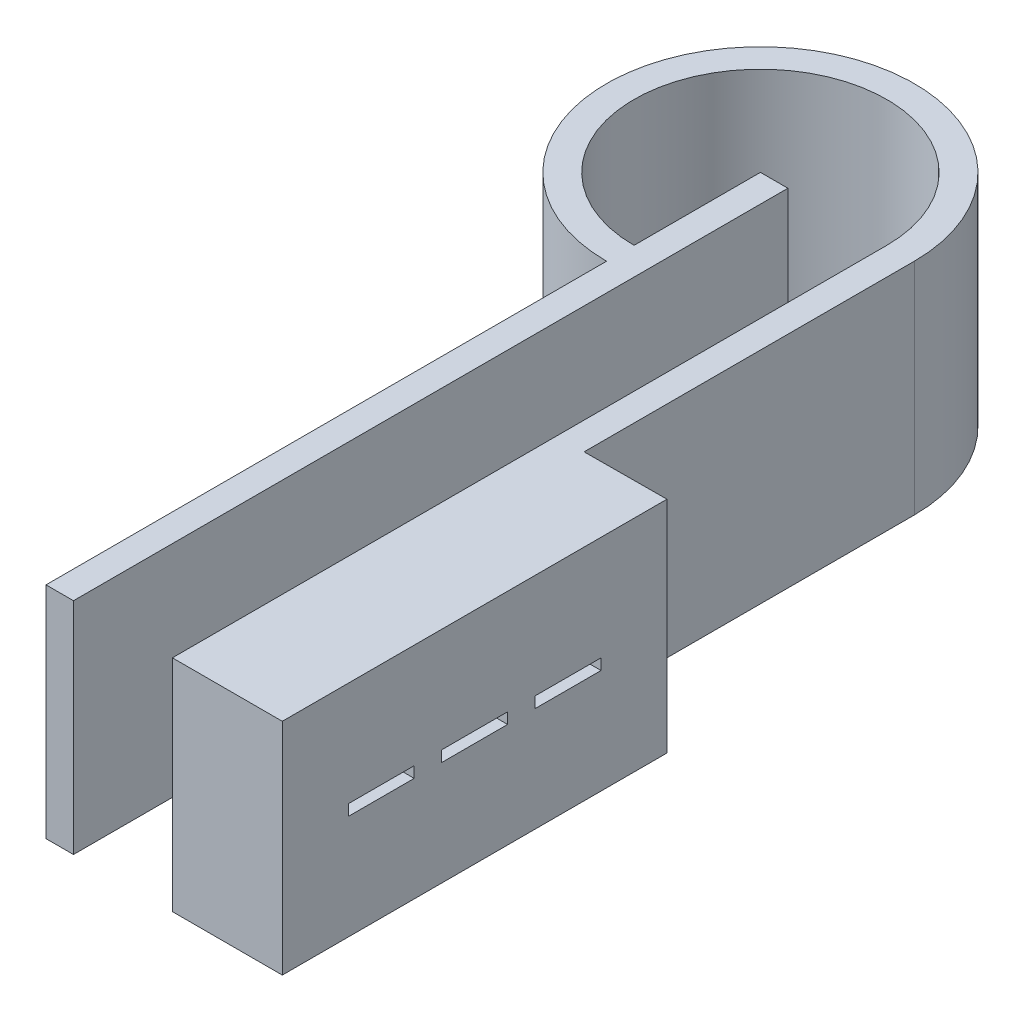
from build123d import *

# Parameters (mm, degrees)
BOSS_EXTRUDE1_DEPTH = 20
SKETCH2_R           = 4
CUT_EXTRUDE2_DEPTH  = 8
CUT_EXTRUDE4_DEPTH  = 10
SKETCH6_W           = 2.5
SKETCH6_H           = 20
SKETCH6_W_2         = 10
BOSS_EXTRUDE3_DEPTH = 5


with BuildPart() as part:
    # Sketch1 → Boss-Extrude1 (new body)
    with BuildSketch(Plane(origin=(0, 0, 0), x_dir=(1, 0, 0), z_dir=(0, 1, 0))):
        with BuildLine():
            Line((-29.801242739, -7.293134051), (-29.801242739, 22.74889672))
            ThreePointArc((-29.801242739, 22.74889672), (-53.700737675, 32.648391657), (-43.801242739, 8.74889672))
            Line((-43.801242739, 8.74889672), (-43.801242739, -37.25110328))
            Line((-43.801242739, -37.25110328), (-41.301242739, -37.25110328))
            Line((-41.301242739, -37.25110328), (-41.301242739, 22.74889672))
            Line((-41.301242739, 22.74889672), (-43.801242739, 22.74889672))
            Line((-43.801242739, 22.74889672), (-43.801242739, 11.24889672))
            ThreePointArc((-43.801242739, 11.24889672), (-51.932970722, 30.880624704), (-32.301242739, 22.74889672))
            Line((-32.301242739, 22.74889672), (-32.301242739, -37.25110328))
            Line((-32.301242739, -37.25110328), (-22.301242739, -37.25110328))
            Line((-22.301242739, -37.25110328), (-22.301242739, -7.25110328))
            Line((-22.301242739, -7.25110328), (-29.801242739, -7.293134051))
        make_face()
    extrude(amount=BOSS_EXTRUDE1_DEPTH)

    # Sketch2 → Cut-Extrude2 (cut)
    with BuildSketch(Plane.ZY.offset(32.301242739)):
        with Locations((16.25110328, 10)):
            Circle(SKETCH2_R)
        with Locations((33.20110328, 10)):
            Circle(SKETCH2_R)
        with Locations((24.75110328, 10)):
            Circle(SKETCH2_R)
    extrude(amount=-CUT_EXTRUDE2_DEPTH, mode=Mode.SUBTRACT)

    # Sketch3 → Cut-Extrude4 (cut)
    with BuildSketch(Plane(origin=(-22.301242739, 0, 0), x_dir=(0, 0, -1), z_dir=(1, 0, 0))):
        Polygon((-24.75110328, 10), (-27.75110328, 10.5), (-27.75110328, 9.5), align=None)
        Polygon((-21.75110328, 10.5), (-27.75110328, 10.5), (-24.75110328, 10), align=None)
        Polygon((-21.75110328, 10.5), (-24.75110328, 10), (-21.75110328, 9.5), align=None)
        Polygon((-21.75110328, 9.5), (-24.75110328, 10), (-27.75110328, 9.5), align=None)
        Polygon((-16.25110328, 10), (-19.25110328, 10.5), (-19.25110328, 9.5), align=None)
        Polygon((-13.25110328, 10.5), (-16.25110328, 10), (-13.25110328, 9.5), align=None)
        Polygon((-13.25110328, 10.5), (-19.25110328, 10.5), (-16.25110328, 10), align=None)
        Polygon((-13.25110328, 9.5), (-16.25110328, 10), (-19.25110328, 9.5), align=None)
        Polygon((-30.25110328, 10.5), (-33.25110328, 10), (-30.25110328, 9.5), align=None)
        Polygon((-30.25110328, 10.5), (-36.25110328, 10.5), (-33.25110328, 10), align=None)
        Polygon((-33.25110328, 10), (-36.25110328, 10.5), (-36.25110328, 9.5), align=None)
        Polygon((-30.25110328, 9.5), (-33.25110328, 10), (-36.25110328, 9.5), align=None)
    extrude(amount=-CUT_EXTRUDE4_DEPTH, mode=Mode.SUBTRACT)

    # Sketch6 → Boss-Extrude3 (add)
    with BuildSketch(Plane.XY.offset(37.25110328)):
        with Locations((-42.551242739, 10)):
            Rectangle(SKETCH6_W, SKETCH6_H)
        with Locations((-27.301242739, 10)):
            Rectangle(SKETCH6_W_2, SKETCH6_H)
    extrude(amount=BOSS_EXTRUDE3_DEPTH)


solid = part.part
